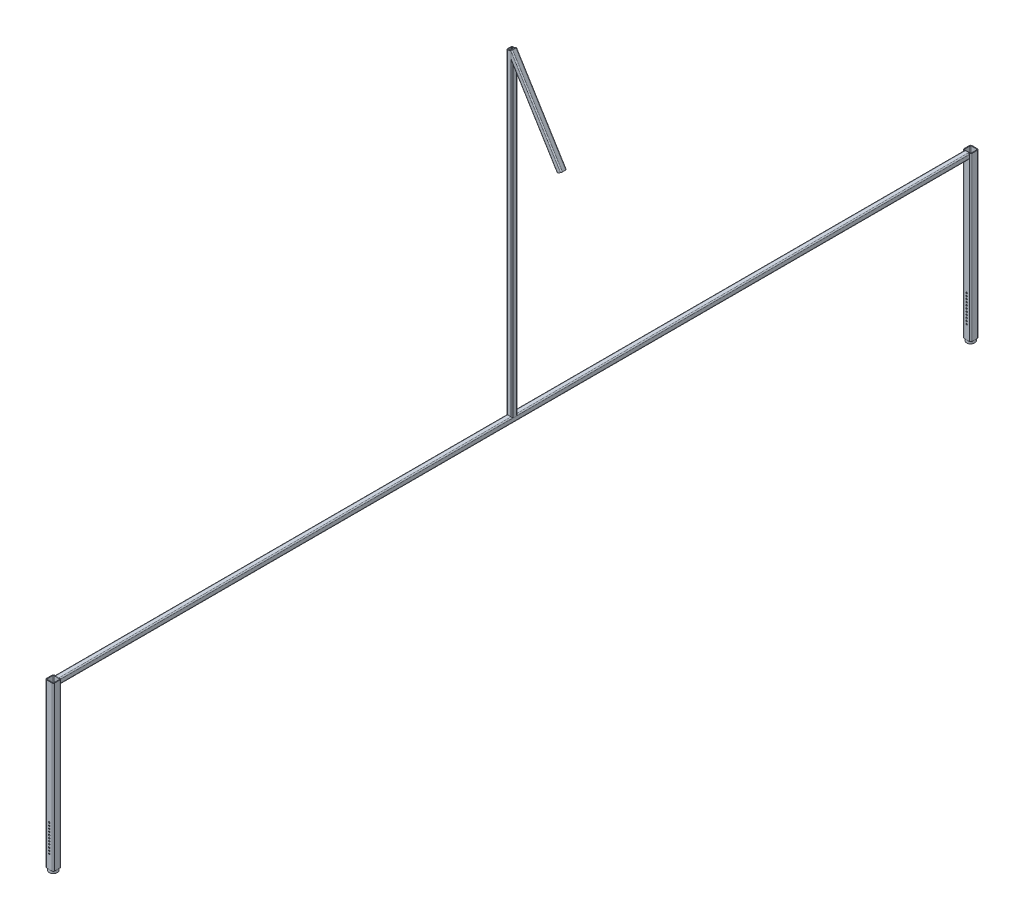
from build123d import *

# Parameters (mm, degrees)
SQUARE_TUBE_20_X_20_X_2_52_DEPTH   = 3350
SQUARE_TUBE_30_X_30_X_2_6_40_DEPTH = 600
SQUARE_TUBE_30_X_30_X_2_6_41_DEPTH = 600
SKETCH150_R                        = 2.5
CUT_EXTRUDE1_DEPTH                 = 3483.65717991
LPATTERN1_COUNT                    = 11
LPATTERN1_PITCH                    = 10
SQUARE_TUBE_20_X_20_X_2_65_DEPTH   = 1175
SQUARE_TUBE_20_X_20_X_2_66_DEPTH   = 350
SKETCH155_R                        = 15
SKETCH155_R_2                      = 12.4
BOSS_EXTRUDE1_DEPTH                = 10
SKETCH156_R                        = 15
SKETCH156_R_2                      = 12.4
BOSS_EXTRUDE2_DEPTH                = 10


with BuildPart() as part:
    # Sketch1 → Square tube 20 X 20 X 2(52) (new body)
    with BuildSketch(Plane(origin=(375.75, 0, 1856.458333333), x_dir=(-1, 0, 0), z_dir=(0, 0, -1))):
        with BuildLine():
            Line((-6, -10), (6, -10))
            ThreePointArc((6, -10), (8.828427125, -8.828427125), (10, -6))
            Line((10, -6), (10, 6))
            ThreePointArc((10, 6), (8.828427125, 8.828427125), (6, 10))
            Line((6, 10), (-6, 10))
            ThreePointArc((-6, 10), (-8.828427125, 8.828427125), (-10, 6))
            Line((-10, 6), (-10, -6))
            ThreePointArc((-10, -6), (-8.828427125, -8.828427125), (-6, -10))
        make_face()
        with BuildLine():
            Line((-6, -8), (6, -8))
            ThreePointArc((6, -8), (7.414213562, -7.414213562), (8, -6))
            Line((8, -6), (8, 6))
            ThreePointArc((8, 6), (7.414213562, 7.414213562), (6, 8))
            Line((6, 8), (-6, 8))
            ThreePointArc((-6, 8), (-7.414213562, 7.414213562), (-8, 6))
            Line((-8, 6), (-8, -6))
            ThreePointArc((-8, -6), (-7.414213562, -7.414213562), (-6, -8))
        make_face(mode=Mode.SUBTRACT)
    extrude(amount=SQUARE_TUBE_20_X_20_X_2_52_DEPTH)


with BuildPart() as body_2:
    # Sketch147 → Square tube 30 X 30 X 2.6(40) (new body)
    with BuildSketch(Plane(origin=(375.769795124, 10, 1871.458333333), x_dir=(1, 0, 0), z_dir=(0, -1, 0))):
        with BuildLine():
            Line((-9.8, -15), (9.8, -15))
            ThreePointArc((9.8, -15), (13.476955262, -13.476955262), (15, -9.8))
            Line((15, -9.8), (15, 9.8))
            ThreePointArc((15, 9.8), (13.476955262, 13.476955262), (9.8, 15))
            Line((9.8, 15), (-9.8, 15))
            ThreePointArc((-9.8, 15), (-13.476955262, 13.476955262), (-15, 9.8))
            Line((-15, 9.8), (-15, -9.8))
            ThreePointArc((-15, -9.8), (-13.476955262, -13.476955262), (-9.8, -15))
        make_face()
        with BuildLine():
            Line((-9.8, -12.4), (9.8, -12.4))
            ThreePointArc((9.8, -12.4), (11.638477631, -11.638477631), (12.4, -9.8))
            Line((12.4, -9.8), (12.4, 9.8))
            ThreePointArc((12.4, 9.8), (11.638477631, 11.638477631), (9.8, 12.4))
            Line((9.8, 12.4), (-9.8, 12.4))
            ThreePointArc((-9.8, 12.4), (-11.638477631, 11.638477631), (-12.4, 9.8))
            Line((-12.4, 9.8), (-12.4, -9.8))
            ThreePointArc((-12.4, -9.8), (-11.638477631, -11.638477631), (-9.8, -12.4))
        make_face(mode=Mode.SUBTRACT)
    extrude(amount=SQUARE_TUBE_30_X_30_X_2_6_40_DEPTH)


with BuildPart() as body_3:
    # Sketch148 → Square tube 30 X 30 X 2.6(41) (new body)
    with BuildSketch(Plane(origin=(375.769795124, 10, -1508.541666667), x_dir=(-1, 0, 0), z_dir=(0, -1, 0))):
        with BuildLine():
            Line((-9.8, -15), (9.8, -15))
            ThreePointArc((9.8, -15), (13.476955262, -13.476955262), (15, -9.8))
            Line((15, -9.8), (15, 9.8))
            ThreePointArc((15, 9.8), (13.476955262, 13.476955262), (9.8, 15))
            Line((9.8, 15), (-9.8, 15))
            ThreePointArc((-9.8, 15), (-13.476955262, 13.476955262), (-15, 9.8))
            Line((-15, 9.8), (-15, -9.8))
            ThreePointArc((-15, -9.8), (-13.476955262, -13.476955262), (-9.8, -15))
        make_face()
        with BuildLine():
            Line((-9.8, -12.4), (9.8, -12.4))
            ThreePointArc((9.8, -12.4), (11.638477631, -11.638477631), (12.4, -9.8))
            Line((12.4, -9.8), (12.4, 9.8))
            ThreePointArc((12.4, 9.8), (11.638477631, 11.638477631), (9.8, 12.4))
            Line((9.8, 12.4), (-9.8, 12.4))
            ThreePointArc((-9.8, 12.4), (-11.638477631, 11.638477631), (-12.4, 9.8))
            Line((-12.4, 9.8), (-12.4, -9.8))
            ThreePointArc((-12.4, -9.8), (-11.638477631, -11.638477631), (-9.8, -12.4))
        make_face(mode=Mode.SUBTRACT)
    extrude(amount=SQUARE_TUBE_30_X_30_X_2_6_41_DEPTH)


with BuildPart() as cut_extrude1_tool:
    # Sketch150 → Cut-Extrude1 (new, symmetric)
    with BuildSketch(Plane(origin=(0, 0, -1523.541666667), x_dir=(-1, 0, 0), z_dir=(0, 0, -1))):
        with Locations((-375.769795124, -540)):
            Circle(SKETCH150_R)
    cut_extrude1 = extrude(amount=CUT_EXTRUDE1_DEPTH, both=True)


with BuildPart() as body_2_1:
    add(body_2.part)

    # Cut-Extrude1: cut by cut_extrude1_tool
    add(cut_extrude1_tool.part, mode=Mode.SUBTRACT)


with BuildPart() as body_3_1:
    add(body_3.part)

    # Cut-Extrude1: cut by cut_extrude1_tool
    add(cut_extrude1_tool.part, mode=Mode.SUBTRACT)


with BuildPart() as lpattern1_tool:
    # LPattern1: Cut-Extrude1 ×11
    with Locations(*[(0, i * LPATTERN1_PITCH, 0) for i in range(1, LPATTERN1_COUNT)]):
        add(cut_extrude1)


with BuildPart() as body_2_2:
    add(body_2_1.part)

    # LPattern1: cut by lpattern1_tool
    add(lpattern1_tool.part, mode=Mode.SUBTRACT)


with BuildPart() as body_3_2:
    add(body_3_1.part)

    # LPattern1: cut by lpattern1_tool
    add(lpattern1_tool.part, mode=Mode.SUBTRACT)


with BuildPart() as body_4:
    # Sketch151 → Square tube 20 X 20 X 2(65) (new body)
    with BuildSketch(Plane(origin=(375.75, 0, 181.458333333), x_dir=(0, 0, 1), z_dir=(0, 1, 0))):
        with BuildLine():
            Line((-6, -10), (6, -10))
            ThreePointArc((6, -10), (8.828427125, -8.828427125), (10, -6))
            Line((10, -6), (10, 6))
            ThreePointArc((10, 6), (8.828427125, 8.828427125), (6, 10))
            Line((6, 10), (-6, 10))
            ThreePointArc((-6, 10), (-8.828427125, 8.828427125), (-10, 6))
            Line((-10, 6), (-10, -6))
            ThreePointArc((-10, -6), (-8.828427125, -8.828427125), (-6, -10))
        make_face()
        with BuildLine():
            Line((-6, -8), (6, -8))
            ThreePointArc((6, -8), (7.414213562, -7.414213562), (8, -6))
            Line((8, -6), (8, 6))
            ThreePointArc((8, 6), (7.414213562, 7.414213562), (6, 8))
            Line((6, 8), (-6, 8))
            ThreePointArc((-6, 8), (-7.414213562, 7.414213562), (-8, 6))
            Line((-8, 6), (-8, -6))
            ThreePointArc((-8, -6), (-7.414213562, -7.414213562), (-6, -8))
        make_face(mode=Mode.SUBTRACT)
    extrude(amount=SQUARE_TUBE_20_X_20_X_2_65_DEPTH)


with BuildPart() as body_5:
    # Sketch154 → Square tube 20 X 20 X 2(66) (new body)
    with BuildSketch(Plane(origin=(375.75, 1175, 181.458333333), x_dir=(0.851360915440357, 0.5245803958027381, 0), z_dir=(0.5245803958027381, -0.851360915440357, 0))):
        with BuildLine():
            Line((-6, -10), (6, -10))
            ThreePointArc((6, -10), (8.828427125, -8.828427125), (10, -6))
            Line((10, -6), (10, 6))
            ThreePointArc((10, 6), (8.828427125, 8.828427125), (6, 10))
            Line((6, 10), (-6, 10))
            ThreePointArc((-6, 10), (-8.828427125, 8.828427125), (-10, 6))
            Line((-10, 6), (-10, -6))
            ThreePointArc((-10, -6), (-8.828427125, -8.828427125), (-6, -10))
        make_face()
        with BuildLine():
            Line((-6, -8), (6, -8))
            ThreePointArc((6, -8), (7.414213562, -7.414213562), (8, -6))
            Line((8, -6), (8, 6))
            ThreePointArc((8, 6), (7.414213562, 7.414213562), (6, 8))
            Line((6, 8), (-6, 8))
            ThreePointArc((-6, 8), (-7.414213562, 7.414213562), (-8, 6))
            Line((-8, 6), (-8, -6))
            ThreePointArc((-8, -6), (-7.414213562, -7.414213562), (-6, -8))
        make_face(mode=Mode.SUBTRACT)
    extrude(amount=SQUARE_TUBE_20_X_20_X_2_66_DEPTH)


with BuildPart() as body_6:
    # Sketch155 → Boss-Extrude1 (new body)
    with BuildSketch(Plane.XZ.offset(590)):
        with Locations((375.769795124, 1871.458333333)):
            Circle(SKETCH155_R)
        with Locations((375.769795124, 1871.458333333)):
            Circle(SKETCH155_R_2, mode=Mode.SUBTRACT)
    extrude(amount=BOSS_EXTRUDE1_DEPTH)


with BuildPart() as body_7:
    # Sketch156 → Boss-Extrude2 (new body)
    with BuildSketch(Plane.XZ.offset(590)):
        with Locations((375.769795124, -1508.541666667)):
            Circle(SKETCH156_R)
        with Locations((375.769795124, -1508.541666667)):
            Circle(SKETCH156_R_2, mode=Mode.SUBTRACT)
    extrude(amount=BOSS_EXTRUDE2_DEPTH)


solid = Compound([part.part, body_2_2.part, body_3_2.part, body_4.part, body_5.part, body_6.part, body_7.part])
